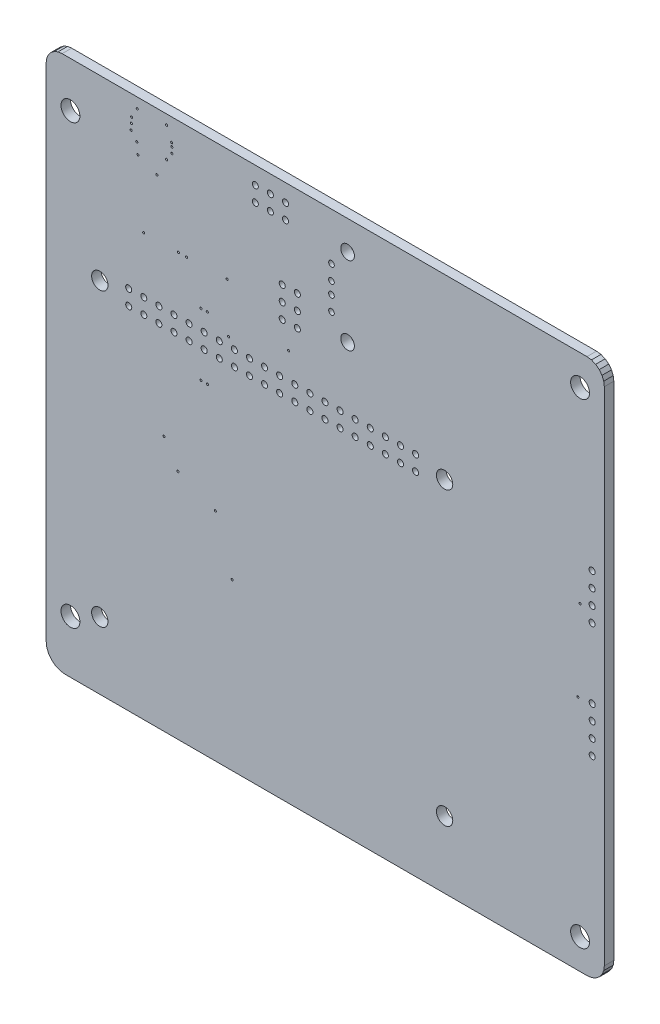
from build123d import *

# Parameters (mm, degrees)
BOARD_OUTLINE_DEPTH = 1.6
ESQUISSE2_R         = 1.59
ESQUISSE2_R_2       = 1.375
ESQUISSE2_R_3       = 1.15
ESQUISSE2_R_4       = 0.175
NPTH_DEPTH          = 131.186485474
ESQUISSE3_R         = 0.51
ESQUISSE3_R_2       = 0.475
PTH_DEPTH           = 131.186485474


with BuildPart() as part:
    # Esquisse1 → Board_Outline (new body)
    with BuildSketch(Plane.XY):
        Polygon((0, 87.475991), (0, 3.194544), (0.108851, 2.367735), (0.427988, 1.597272), (0.93566, 0.93566), (1.597272, 0.427988), (2.367735, 0.108851), (3.194544, 0), (91.011053, 0), (91.756179, 0.098098), (92.450527, 0.385706), (93.046776, 0.843224), (93.504294, 1.439473), (93.791902, 2.133821), (93.89, 2.878947), (93.89, 87.252531), (93.79059, 88.007628), (93.499133, 88.711266), (93.035493, 89.315493), (92.431266, 89.779133), (91.727628, 90.07059), (90.972531, 90.17), (2.694009, 90.17), (1.996748, 90.078204), (1.347005, 89.809071), (0.789057, 89.380943), (0.360929, 88.822995), (0.091796, 88.173252), align=None)
    extrude(amount=BOARD_OUTLINE_DEPTH)

    # Esquisse2 → NPTH (cut, through all)
    with BuildSketch(Plane.XY):
        with Locations((4.08, 8.89)):
            Circle(ESQUISSE2_R)
        with Locations((89.81, 5.08)):
            Circle(ESQUISSE2_R)
        with Locations((89.81, 85.09)):
            Circle(ESQUISSE2_R)
        with Locations((4.08, 82.55)):
            Circle(ESQUISSE2_R)
        with Locations((9.02, 11.27)):
            Circle(ESQUISSE2_R_2)
        with Locations((67.02, 11.27)):
            Circle(ESQUISSE2_R_2)
        with Locations((9.02, 60.27)):
            Circle(ESQUISSE2_R_2)
        with Locations((67.02, 60.27)):
            Circle(ESQUISSE2_R_2)
        with Locations((50.7014, 72.1304)):
            Circle(ESQUISSE2_R_3)
        with Locations((50.7014, 85.2704)):
            Circle(ESQUISSE2_R_3)
        with Locations((89.4403, 39.8087)):
            Circle(ESQUISSE2_R_4)
        with Locations((15.24, 83.5914)):
            Circle(ESQUISSE2_R_4)
        with Locations((20.2438, 83.5152)):
            Circle(ESQUISSE2_R_4)
        with Locations((15.4432, 81.8134)):
            Circle(ESQUISSE2_R_4)
        with Locations((18.6182, 80.4926)):
            Circle(ESQUISSE2_R_4)
        with Locations((15.3162, 88.4428)):
            Circle(ESQUISSE2_R_4)
        with Locations((20.2438, 88.5444)):
            Circle(ESQUISSE2_R_4)
        with Locations((14.3764, 86.7664)):
            Circle(ESQUISSE2_R_4)
        with Locations((14.3256, 85.852)):
            Circle(ESQUISSE2_R_4)
        with Locations((14.3002, 84.8106)):
            Circle(ESQUISSE2_R_4)
        with Locations((21.1074, 86.4362)):
            Circle(ESQUISSE2_R_4)
        with Locations((21.1328, 85.8012)):
            Circle(ESQUISSE2_R_4)
        with Locations((21.1328, 84.836)):
            Circle(ESQUISSE2_R_4)
        with Locations((30.4292, 71.1708)):
            Circle(ESQUISSE2_R_4)
        with Locations((19.8374, 42.9768)):
            Circle(ESQUISSE2_R_4)
        with Locations((16.4084, 70.9168)):
            Circle(ESQUISSE2_R_4)
        with Locations((22.1742, 39.0398)):
            Circle(ESQUISSE2_R_4)
        with Locations((28.455, 36.445)):
            Circle(ESQUISSE2_R_4)
        with Locations((31.2928, 27.8384)):
            Circle(ESQUISSE2_R_4)
        with Locations((26.03, 64.7206)):
            Circle(ESQUISSE2_R_4)
        with Locations((26.0362, 54.2606)):
            Circle(ESQUISSE2_R_4)
        with Locations((27.1, 64.76)):
            Circle(ESQUISSE2_R_4)
        with Locations((27.12, 54.2306)):
            Circle(ESQUISSE2_R_4)
        with Locations((30.6959, 62.9259)):
            Circle(ESQUISSE2_R_4)
        with Locations((40.76, 65.94)):
            Circle(ESQUISSE2_R_4)
        with Locations((89.8178, 53.6042)):
            Circle(ESQUISSE2_R_4)
        with Locations((22.2632, 71)):
            Circle(ESQUISSE2_R_4)
        with Locations((23.6162, 70.9838)):
            Circle(ESQUISSE2_R_4)
    extrude(amount=NPTH_DEPTH, mode=Mode.SUBTRACT)

    # Esquisse3 → PTH (cut, through all)
    with BuildSketch(Plane.XY):
        with Locations((91.83, 51.79)):
            Circle(ESQUISSE3_R)
        with Locations((91.83, 54.33)):
            Circle(ESQUISSE3_R)
        with Locations((91.83, 56.87)):
            Circle(ESQUISSE3_R)
        with Locations((91.83, 59.41)):
            Circle(ESQUISSE3_R)
        with Locations((91.85, 32.44)):
            Circle(ESQUISSE3_R)
        with Locations((91.85, 34.98)):
            Circle(ESQUISSE3_R)
        with Locations((91.85, 37.52)):
            Circle(ESQUISSE3_R)
        with Locations((91.85, 40.06)):
            Circle(ESQUISSE3_R)
        with Locations((35.18, 84.71)):
            Circle(ESQUISSE3_R)
        with Locations((35.18, 87.25)):
            Circle(ESQUISSE3_R)
        with Locations((37.72, 84.71)):
            Circle(ESQUISSE3_R)
        with Locations((37.72, 87.25)):
            Circle(ESQUISSE3_R)
        with Locations((40.26, 84.71)):
            Circle(ESQUISSE3_R)
        with Locations((40.26, 87.25)):
            Circle(ESQUISSE3_R)
        with Locations((39.71, 75.02)):
            Circle(ESQUISSE3_R)
        with Locations((42.25, 75.02)):
            Circle(ESQUISSE3_R)
        with Locations((39.71, 72.48)):
            Circle(ESQUISSE3_R)
        with Locations((42.25, 72.48)):
            Circle(ESQUISSE3_R)
        with Locations((39.71, 69.94)):
            Circle(ESQUISSE3_R)
        with Locations((42.25, 69.94)):
            Circle(ESQUISSE3_R)
        with Locations((13.89, 59)):
            Circle(ESQUISSE3_R)
        with Locations((13.88, 61.54)):
            Circle(ESQUISSE3_R)
        with Locations((16.42, 59)):
            Circle(ESQUISSE3_R)
        with Locations((16.42, 61.54)):
            Circle(ESQUISSE3_R)
        with Locations((18.96, 59)):
            Circle(ESQUISSE3_R)
        with Locations((18.96, 61.54)):
            Circle(ESQUISSE3_R)
        with Locations((21.5, 59)):
            Circle(ESQUISSE3_R)
        with Locations((21.5, 61.54)):
            Circle(ESQUISSE3_R)
        with Locations((24.04, 59)):
            Circle(ESQUISSE3_R)
        with Locations((24.04, 61.54)):
            Circle(ESQUISSE3_R)
        with Locations((26.58, 59)):
            Circle(ESQUISSE3_R)
        with Locations((26.58, 61.54)):
            Circle(ESQUISSE3_R)
        with Locations((29.12, 59)):
            Circle(ESQUISSE3_R)
        with Locations((29.12, 61.54)):
            Circle(ESQUISSE3_R)
        with Locations((31.66, 59)):
            Circle(ESQUISSE3_R)
        with Locations((31.66, 61.54)):
            Circle(ESQUISSE3_R)
        with Locations((34.2, 59)):
            Circle(ESQUISSE3_R)
        with Locations((34.2, 61.54)):
            Circle(ESQUISSE3_R)
        with Locations((36.74, 59)):
            Circle(ESQUISSE3_R)
        with Locations((36.74, 61.54)):
            Circle(ESQUISSE3_R)
        with Locations((39.28, 59)):
            Circle(ESQUISSE3_R)
        with Locations((39.28, 61.54)):
            Circle(ESQUISSE3_R)
        with Locations((41.82, 59)):
            Circle(ESQUISSE3_R)
        with Locations((41.82, 61.54)):
            Circle(ESQUISSE3_R)
        with Locations((44.36, 59)):
            Circle(ESQUISSE3_R)
        with Locations((44.36, 61.54)):
            Circle(ESQUISSE3_R)
        with Locations((46.9, 59)):
            Circle(ESQUISSE3_R)
        with Locations((46.9, 61.54)):
            Circle(ESQUISSE3_R)
        with Locations((49.44, 59)):
            Circle(ESQUISSE3_R)
        with Locations((49.44, 61.54)):
            Circle(ESQUISSE3_R)
        with Locations((51.98, 59)):
            Circle(ESQUISSE3_R)
        with Locations((51.98, 61.54)):
            Circle(ESQUISSE3_R)
        with Locations((54.52, 59)):
            Circle(ESQUISSE3_R)
        with Locations((54.52, 61.54)):
            Circle(ESQUISSE3_R)
        with Locations((57.06, 59)):
            Circle(ESQUISSE3_R)
        with Locations((57.06, 61.54)):
            Circle(ESQUISSE3_R)
        with Locations((59.6, 59)):
            Circle(ESQUISSE3_R)
        with Locations((59.6, 61.54)):
            Circle(ESQUISSE3_R)
        with Locations((62.14, 59)):
            Circle(ESQUISSE3_R)
        with Locations((62.14, 61.54)):
            Circle(ESQUISSE3_R)
        with Locations((47.99, 75.2)):
            Circle(ESQUISSE3_R_2)
        with Locations((47.99, 77.7)):
            Circle(ESQUISSE3_R_2)
        with Locations((47.99, 79.7)):
            Circle(ESQUISSE3_R_2)
        with Locations((47.99, 82.2)):
            Circle(ESQUISSE3_R_2)
    extrude(amount=PTH_DEPTH, mode=Mode.SUBTRACT)


solid = part.part
